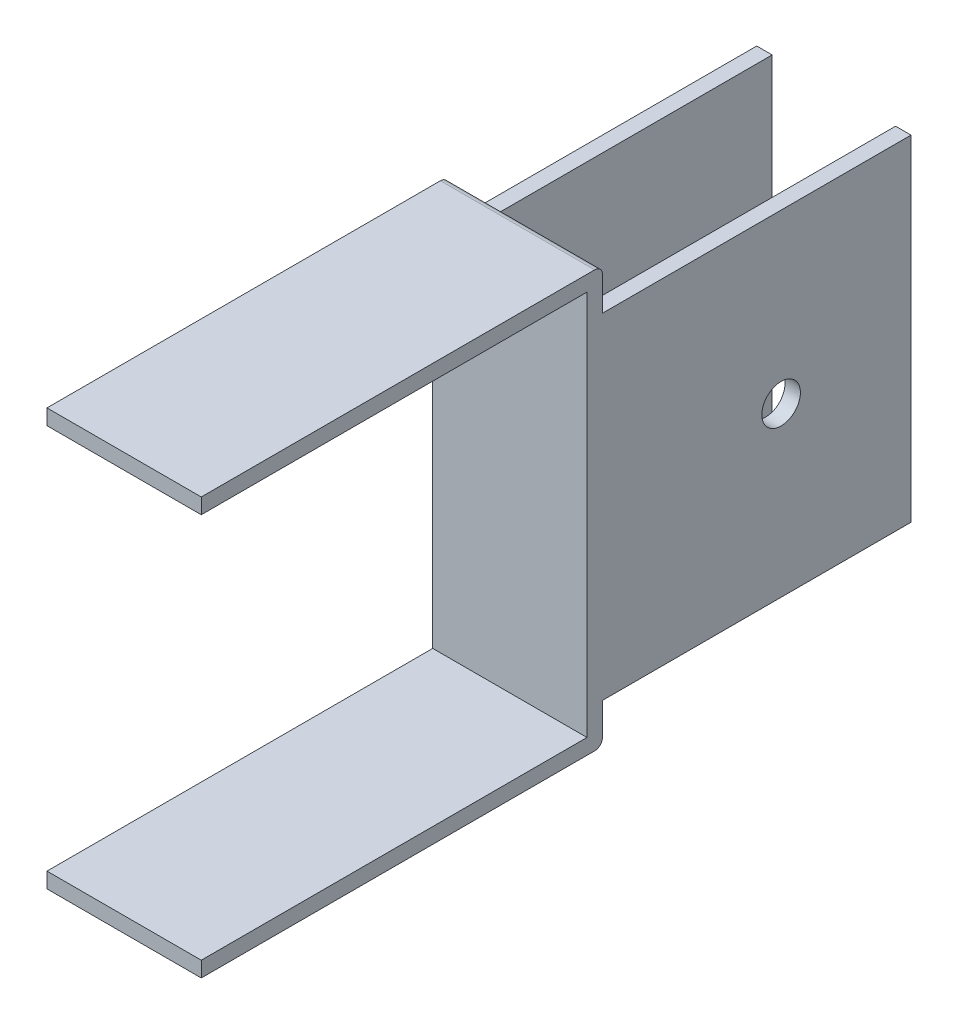
from build123d import *

# Parameters (mm, degrees)
SKETCH1_W           = 20
SKETCH1_H           = 54
BOSS_EXTRUDE1_DEPTH = 2
SKETCH2_W           = 20
SKETCH2_H           = 2
BOSS_EXTRUDE2_DEPTH = 50
FILLET1_R           = 1
SKETCH3_W           = 2
SKETCH3_H           = 43.466929313
BOSS_EXTRUDE3_DEPTH = 40
SKETCH4_R           = 2.5
CUT_EXTRUDE1_DEPTH  = 78.588658965


with BuildPart() as part:
    # Sketch1 → Boss-Extrude1 (new body)
    with BuildSketch(Plane.XY):
        with Locations((10, 27)):
            Rectangle(SKETCH1_W, SKETCH1_H)
    extrude(amount=BOSS_EXTRUDE1_DEPTH)

    # Sketch2 → Boss-Extrude2 (add)
    with BuildSketch(Plane.XY.offset(2)):
        with Locations((10, 53)):
            Rectangle(SKETCH2_W, SKETCH2_H)
        with Locations((10, 1)):
            Rectangle(SKETCH2_W, SKETCH2_H)
    extrude(amount=BOSS_EXTRUDE2_DEPTH)

    # Fillet1
    fillet1_edges = [part.edges().sort_by_distance(p)[0] for p in [
        (10, 54, 0),
        (10, 0, 0),
    ]]
    fillet(fillet1_edges, radius=FILLET1_R)

    # Sketch3 → Boss-Extrude3 (add)
    with BuildSketch(Plane(origin=(0, 0, 0), x_dir=(-1, 0, 0), z_dir=(0, 0, -1))):
        with Locations((-19, 26.891060328)):
            Rectangle(SKETCH3_W, SKETCH3_H)
        with Locations((-1, 26.891060328)):
            Rectangle(SKETCH3_W, SKETCH3_H)
    extrude(amount=BOSS_EXTRUDE3_DEPTH)

    # Sketch4 → Cut-Extrude1 (cut, through all)
    with BuildSketch(Plane(origin=(20, 0, 0), x_dir=(0, 0, -1), z_dir=(1, 0, 0))):
        with Locations((23.160609429, 26.891060328)):
            Circle(SKETCH4_R)
    extrude(amount=-CUT_EXTRUDE1_DEPTH, mode=Mode.SUBTRACT)


solid = part.part
